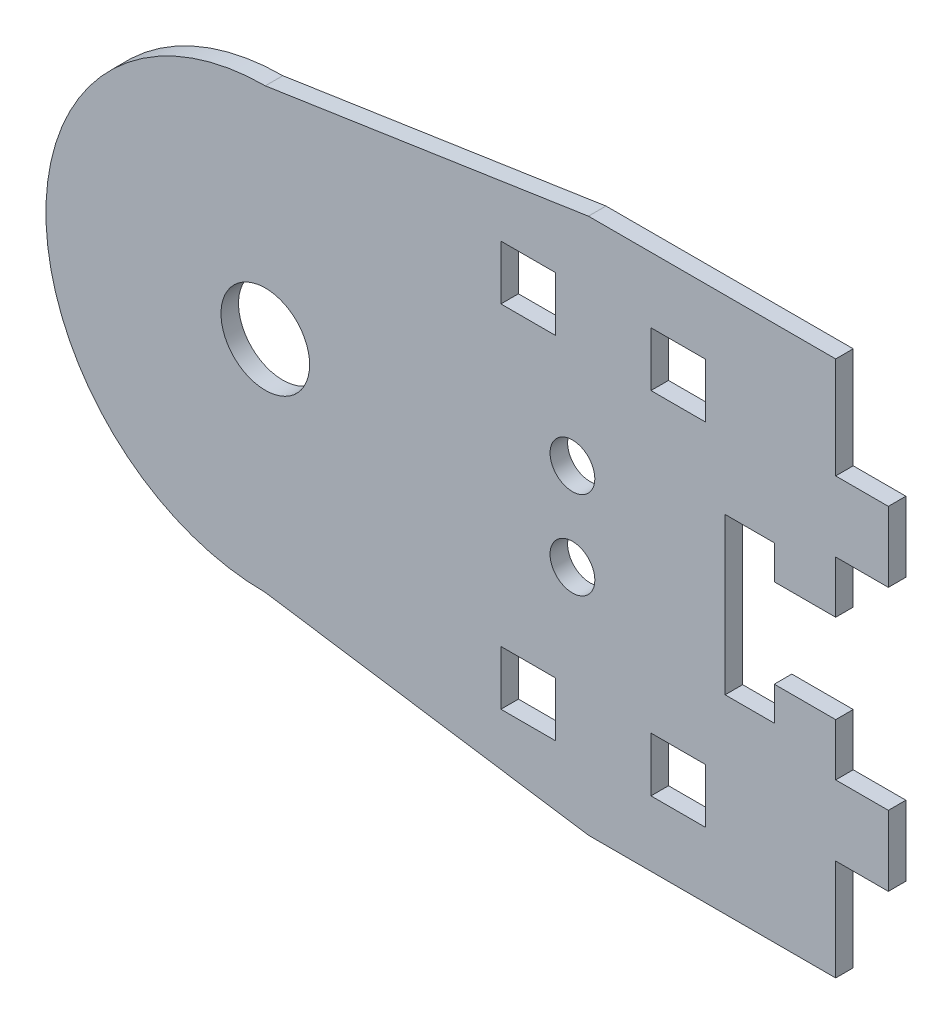
from build123d import *

# Parameters (mm, degrees)
SKETCH_1_R      = 5.05
SKETCH_1_R_2    = 2.55
SKETCH_1_W      = 6.2
SKETCH_1_H      = 6.2
EXTRUDE_1_DEPTH = 2


with BuildPart() as part:
    # 草图1 → 凸台-拉伸1 (new body)
    with BuildSketch(Plane.XY):
        with BuildLine():
            Line((0, -25), (36.822908512, -30.548036369))
            Line((36.822908512, -30.548036369), (65, -30.548036369))
            Line((65, -30.548036369), (65, -19))
            Line((65, -19), (71, -19))
            Line((71, -19), (71, -11))
            Line((71, -11), (65, -11))
            Line((65, -11), (65, -5.05))
            Line((65, -5.05), (58, -5.05))
            Line((58, -5.05), (58, -8.9))
            Line((58, -8.9), (52.4, -8.9))
            Line((52.4, -8.9), (52.4, -5.15))
            Line((52.4, -5.15), (52.4, 5.15))
            Line((52.4, 5.15), (52.4, 8.9))
            Line((52.4, 8.9), (58, 8.9))
            Line((58, 8.9), (58, 5.05))
            Line((58, 5.05), (65, 5.05))
            Line((65, 5.05), (65, 11))
            Line((65, 11), (71, 11))
            Line((71, 11), (71, 19))
            Line((71, 19), (65, 19))
            Line((65, 19), (65, 30.548036369))
            Line((65, 30.548036369), (36.822908512, 30.548036369))
            Line((36.822908512, 30.548036369), (0, 25))
            ThreePointArc((0, 25), (-25, 0), (0, -25))
        make_face()
        Circle(SKETCH_1_R, mode=Mode.SUBTRACT)
        with Locations((35, 5)):
            Circle(SKETCH_1_R_2, mode=Mode.SUBTRACT)
        with Locations(Location((35, -5, 0), (0, 0, 180))):
            Circle(SKETCH_1_R_2, mode=Mode.SUBTRACT)
        with Locations((47.05, -20)):
            Rectangle(SKETCH_1_W, SKETCH_1_H, mode=Mode.SUBTRACT)
        with Locations((29.95, -20)):
            Rectangle(SKETCH_1_W, SKETCH_1_H, mode=Mode.SUBTRACT)
        with Locations((29.95, 20)):
            Rectangle(SKETCH_1_W, SKETCH_1_H, mode=Mode.SUBTRACT)
        with Locations((47.05, 20)):
            Rectangle(SKETCH_1_W, SKETCH_1_H, mode=Mode.SUBTRACT)
    extrude(amount=EXTRUDE_1_DEPTH)


solid = part.part
